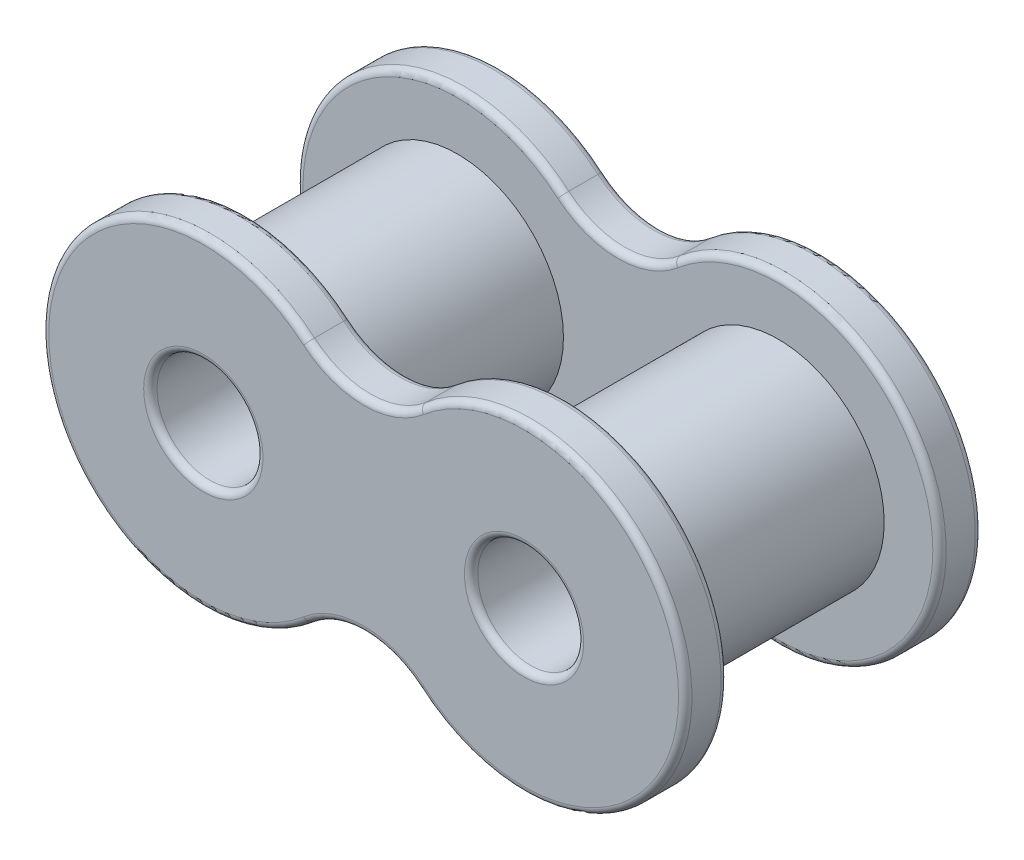
from build123d import *

# Parameters (mm, degrees)
ESBO_O1_R                = 1.9812
RESSALTO_EXTRUS_O1_DEPTH = 1.5875
FILETE1_R                = 0.25
ESBO_O2_R                = 3.9624
ESBO_O2_R_2              = 1.9812
RESSALTO_EXTRUS_O2_DEPTH = 7.9248
FILETE1_OF_ESPELHAR2_R   = 0.25
FILETE2_R                = 0.25


with BuildPart() as part:
    # Esboço1 → Ressalto-extrusão1 (new body)
    with BuildSketch(Plane.XY):
        with BuildLine():
            ThreePointArc((-2.085587031, 4.59003566), (-12.0325, 0), (-2.085587031, -4.59003566))
            ThreePointArc((-2.085587031, -4.59003566), (0, -3.821495155), (2.085587031, -4.59003566))
            ThreePointArc((2.085587031, -4.59003566), (12.0325, 0), (2.085587031, 4.59003566))
            ThreePointArc((2.085587031, 4.59003566), (0, 3.821495155), (-2.085587031, 4.59003566))
        make_face()
        with Locations((-6, 0)):
            Circle(ESBO_O1_R, mode=Mode.SUBTRACT)
        with Locations(Location((6, 0, 0), (0, 0, 180))):
            Circle(ESBO_O1_R, mode=Mode.SUBTRACT)
    ressalto_extrus_o1 = extrude(amount=RESSALTO_EXTRUS_O1_DEPTH)

    # Filete1
    filete1_edges = [part.edges().sort_by_distance(p)[0] for p in [
        (0, -3.821495155, 1.5875),
        (12.0325, 0, 1.5875),
        (0, 3.821495155, 1.5875),
        (12.0325, 0, 0),
        (0, -3.821495155, 0),
        (-12.0325, 0, 0),
        (0, 3.821495155, 0),
        (-12.0325, 0, 1.5875),
    ]]
    fillet(filete1_edges, radius=FILETE1_R)

    # Esboço2 → Ressalto-extrusão2 (add)
    with BuildSketch(Plane.XY.offset(1.5875)):
        with Locations((-6, 0)):
            Circle(ESBO_O2_R)
        with Locations((-6, 0)):
            Circle(ESBO_O2_R_2, mode=Mode.SUBTRACT)
    ressalto_extrus_o2 = extrude(amount=RESSALTO_EXTRUS_O2_DEPTH)

    # Espelhar1: Ressalto-extrusão2 across plane
    add(ressalto_extrus_o2.mirror(Plane(origin=(0, 0, 0), x_dir=(0, 0, 1), z_dir=(1, 0, 0))))

    # Espelhar2: Ressalto-extrusão1 across plane
    add(ressalto_extrus_o1.mirror(Plane.XY.offset(5.5499)))

    # Filete1 of Espelhar2
    filete1_of_espelhar2_edges = [part.edges().sort_by_distance(p)[0] for p in [
        (0, -3.821495155, 9.5123),
        (12.0325, 0, 9.5123),
        (0, 3.821495155, 9.5123),
        (12.0325, 0, 11.0998),
        (0, -3.821495155, 11.0998),
        (-12.0325, 0, 11.0998),
        (0, 3.821495155, 11.0998),
        (-12.0325, 0, 9.5123),
    ]]
    fillet(filete1_of_espelhar2_edges, radius=FILETE1_OF_ESPELHAR2_R)

    # Filete2
    filete2_edges = [part.edges().sort_by_distance(p)[0] for p in [
        (-7.9812, 0, 0),
        (7.9812, 0, 0),
        (-7.9812, 0, 11.0998),
        (7.9812, 0, 11.0998),
    ]]
    fillet(filete2_edges, radius=FILETE2_R)


solid = part.part
